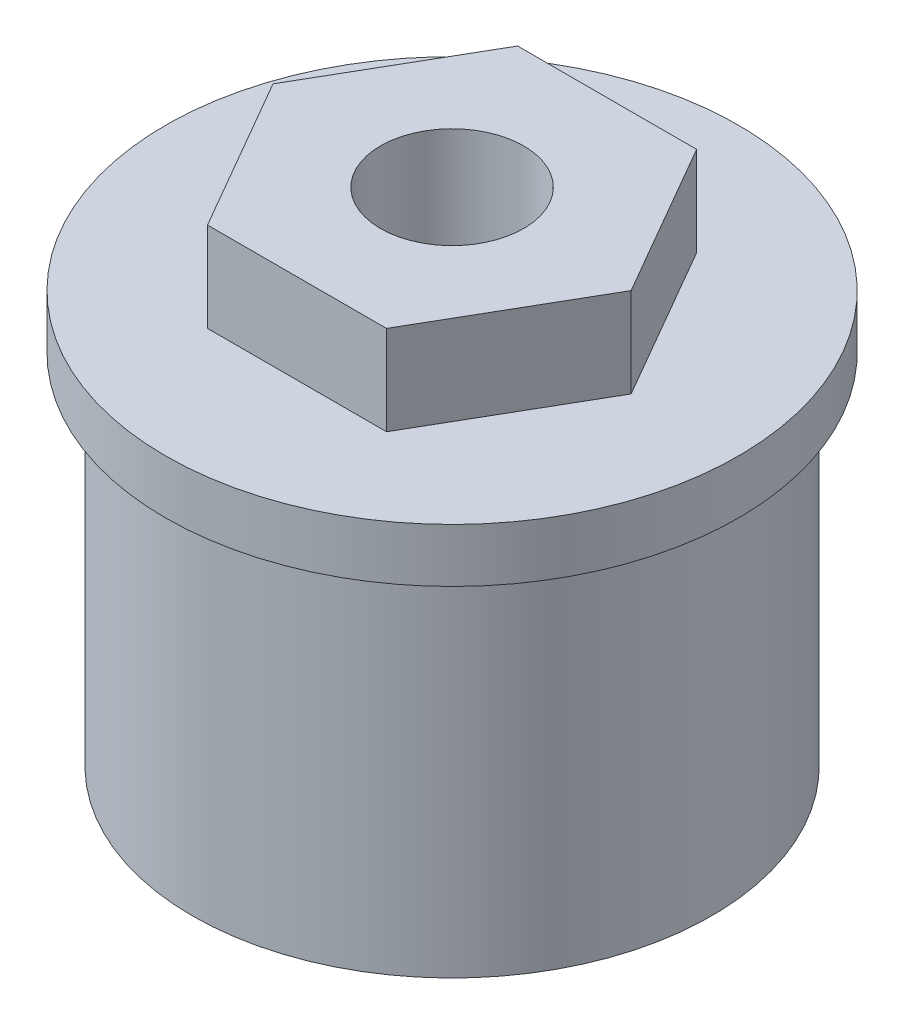
from build123d import *

# Parameters (mm, degrees)
SKETCH1_R           = 14.5
BOSS_EXTRUDE1_DEPTH = 20
SKETCH2_R           = 16
BOSS_EXTRUDE2_DEPTH = 3
BOSS_EXTRUDE3_DEPTH = 5
SKETCH4_R           = 4
CUT_EXTRUDE1_DEPTH  = 30


with BuildPart() as part:
    # Sketch1 → Boss-Extrude1 (new body)
    with BuildSketch(Plane(origin=(0, 0, 0), x_dir=(1, 0, 0), z_dir=(0, 1, 0))):
        with Locations(Location((0, 0, 0), (0, 0, 270))):
            Circle(SKETCH1_R)
    extrude(amount=BOSS_EXTRUDE1_DEPTH)

    # Sketch2 → Boss-Extrude2 (add)
    with BuildSketch(Plane(origin=(0, 20, 0), x_dir=(1, 0, 0), z_dir=(0, 1, 0))):
        with Locations(Location((0, 0, 0), (0, 0, 270))):
            Circle(SKETCH2_R)
    extrude(amount=BOSS_EXTRUDE2_DEPTH)

    # Sketch3 → Boss-Extrude3 (add)
    with BuildSketch(Plane(origin=(0, 23, 0), x_dir=(1, 0, 0), z_dir=(0, 1, 0))):
        Polygon((10, 0), (5, 8.660254038), (-5, 8.660254038), (-10, 0), (-5, -8.660254038), (5, -8.660254038), align=None)
    extrude(amount=BOSS_EXTRUDE3_DEPTH)

    # Sketch4 → Cut-Extrude1 (cut)
    with BuildSketch(Plane(origin=(0, 28, 0), x_dir=(1, 0, 0), z_dir=(0, 1, 0))):
        with Locations(Location((0, 0, 0), (0, 0, 270))):
            Circle(SKETCH4_R)
    extrude(amount=-CUT_EXTRUDE1_DEPTH, mode=Mode.SUBTRACT)


solid = part.part
